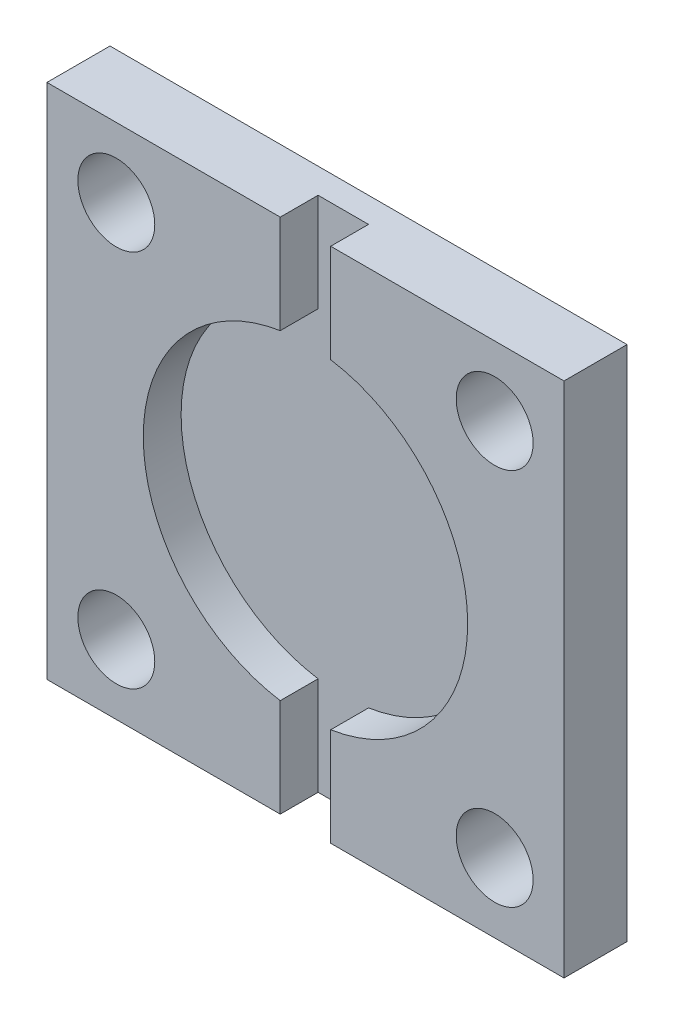
from build123d import *

# Parameters (mm, degrees)
CROQUIS1_W             = 41
CROQUIS1_H             = 41
PLAQUEBASE_DEPTH       = 5
CROQUIS2_R             = 12.86
CERCLECENTRAL_DEPTH    = 3
CROQUIS3_R             = 3.05
SUPPORT_DEPTH          = 5
CROQUIS4_W             = 3
CROQUIS4_H             = 2.5
TROUSLAT_DEPTH         = 41
CORTAR_EXTRUIR1_DEPTH  = 0.5
CORTAR_EXTRUIR2_DEPTH  = 0.5
CROQUIS15_W            = 7.727780146
CROQUIS15_H            = 3
CORTAR_EXTRUIR3_DEPTH  = 0.5
CROQUIS16_W            = 7.727780146
CROQUIS16_H            = 3
CORTAR_EXTRUIR4_DEPTH  = 0.5
CROQUIS17_W            = 7.727780146
CROQUIS17_H            = 3
CORTAR_EXTRUIR5_DEPTH  = 0.5
CROQUIS18_W            = 7.727780146
CROQUIS18_H            = 3
CORTAR_EXTRUIR6_DEPTH  = 0.5
CROQUIS19_W            = 0.5
CROQUIS19_H            = 3
CORTAR_EXTRUIR7_DEPTH  = 0.5
CROQUIS20_W            = 0.5
CROQUIS20_H            = 3
CORTAR_EXTRUIR8_DEPTH  = 0.5
CROQUIS21_W            = 0.5
CROQUIS21_H            = 3
CORTAR_EXTRUIR9_DEPTH  = 0.5
CROQUIS22_W            = 0.5
CROQUIS22_H            = 3
CORTAR_EXTRUIR10_DEPTH = 0.5


with BuildPart() as part:
    # Croquis1 → PlaqueBase (new body)
    with BuildSketch(Plane(origin=(0, 0, 0), x_dir=(0, 1, 0), z_dir=(0, 0, 1))):
        with Locations((20.5, 20.5)):
            Rectangle(CROQUIS1_W, CROQUIS1_H)
    extrude(amount=PLAQUEBASE_DEPTH)

    # Croquis2 → CercleCentral (cut)
    with BuildSketch(Plane.XY.offset(5)):
        with Locations((-20.5, 20.5)):
            Circle(CROQUIS2_R)
    extrude(amount=-CERCLECENTRAL_DEPTH, mode=Mode.SUBTRACT)

    # Croquis3 → Support (cut)
    with BuildSketch(Plane.XY.offset(5)):
        with Locations((-35.5, 5.5)):
            Circle(CROQUIS3_R)
        with Locations((-5.5, 5.5)):
            Circle(CROQUIS3_R)
        with Locations((-5.5, 35.5)):
            Circle(CROQUIS3_R)
        with Locations((-35.5, 35.5)):
            Circle(CROQUIS3_R)
    extrude(amount=-SUPPORT_DEPTH, mode=Mode.SUBTRACT)

    # Croquis4 → TrousLat (cut)
    with BuildSketch(Plane(origin=(0, 0, 0), x_dir=(-1, 0, 0), z_dir=(0, -1, 0))):
        with Locations((20.5, -3.75)):
            Rectangle(CROQUIS4_W, CROQUIS4_H)
    extrude(amount=-TROUSLAT_DEPTH, mode=Mode.SUBTRACT)

    # Croquis6 → Cortar-Extruir1 (cut)
    with BuildSketch(Plane.XY.offset(2.5)):
        with BuildLine():
            Line((-19, 33.272219854), (-19, 41))
            Line((-19, 41), (-22, 41))
            Line((-22, 41), (-22, 33.272219854))
            ThreePointArc((-22, 33.272219854), (-20.5, 33.36), (-19, 33.272219854))
        make_face()
    extrude(amount=-CORTAR_EXTRUIR1_DEPTH, mode=Mode.SUBTRACT)

    # Croquis14 → Cortar-Extruir2 (cut)
    with BuildSketch(Plane.XY.offset(2.5)):
        with BuildLine():
            Line((-22, 7.727780146), (-22, 0))
            Line((-22, 0), (-19, 0))
            Line((-19, 0), (-19, 7.727780146))
            ThreePointArc((-19, 7.727780146), (-20.5, 7.64), (-22, 7.727780146))
        make_face()
    extrude(amount=-CORTAR_EXTRUIR2_DEPTH, mode=Mode.SUBTRACT)

    # Croquis15 → Cortar-Extruir3 (cut)
    with BuildSketch(Plane(origin=(-19, 0, 0), x_dir=(0, -1, 0), z_dir=(-1, 0, 0))):
        with Locations((-37.136109927, 3.5)):
            Rectangle(CROQUIS15_W, CROQUIS15_H)
    extrude(amount=-CORTAR_EXTRUIR3_DEPTH, mode=Mode.SUBTRACT)

    # Croquis16 → Cortar-Extruir4 (cut)
    with BuildSketch(Plane(origin=(-19, 0, 0), x_dir=(0, -1, 0), z_dir=(-1, 0, 0))):
        with Locations((-3.863890073, 3.5)):
            Rectangle(CROQUIS16_W, CROQUIS16_H)
    extrude(amount=-CORTAR_EXTRUIR4_DEPTH, mode=Mode.SUBTRACT)

    # Croquis17 → Cortar-Extruir5 (cut)
    with BuildSketch(Plane.YZ.offset(-22)):
        with Locations((3.863890073, 3.5)):
            Rectangle(CROQUIS17_W, CROQUIS17_H)
    extrude(amount=-CORTAR_EXTRUIR5_DEPTH, mode=Mode.SUBTRACT)

    # Croquis18 → Cortar-Extruir6 (cut)
    with BuildSketch(Plane.YZ.offset(-22)):
        with Locations((37.136109927, 3.5)):
            Rectangle(CROQUIS18_W, CROQUIS18_H)
    extrude(amount=-CORTAR_EXTRUIR6_DEPTH, mode=Mode.SUBTRACT)

    # Croquis19 → Cortar-Extruir7 (cut)
    with BuildSketch(Plane.XZ.offset(-7.727780146)):
        with Locations((-22.25, 3.5)):
            Rectangle(CROQUIS19_W, CROQUIS19_H)
    extrude(amount=-CORTAR_EXTRUIR7_DEPTH, mode=Mode.SUBTRACT)

    # Croquis20 → Cortar-Extruir8 (cut)
    with BuildSketch(Plane.XZ.offset(-7.727780146)):
        with Locations((-18.75, 3.5)):
            Rectangle(CROQUIS20_W, CROQUIS20_H)
    extrude(amount=-CORTAR_EXTRUIR8_DEPTH, mode=Mode.SUBTRACT)

    # Croquis21 → Cortar-Extruir9 (cut)
    with BuildSketch(Plane(origin=(0, 33.272219854, 0), x_dir=(-1, 0, 0), z_dir=(0, 1, 0))):
        with Locations((18.75, 3.5)):
            Rectangle(CROQUIS21_W, CROQUIS21_H)
    extrude(amount=-CORTAR_EXTRUIR9_DEPTH, mode=Mode.SUBTRACT)

    # Croquis22 → Cortar-Extruir10 (cut)
    with BuildSketch(Plane(origin=(0, 33.272219854, 0), x_dir=(-1, 0, 0), z_dir=(0, 1, 0))):
        with Locations((22.25, 3.5)):
            Rectangle(CROQUIS22_W, CROQUIS22_H)
    extrude(amount=-CORTAR_EXTRUIR10_DEPTH, mode=Mode.SUBTRACT)


solid = part.part
